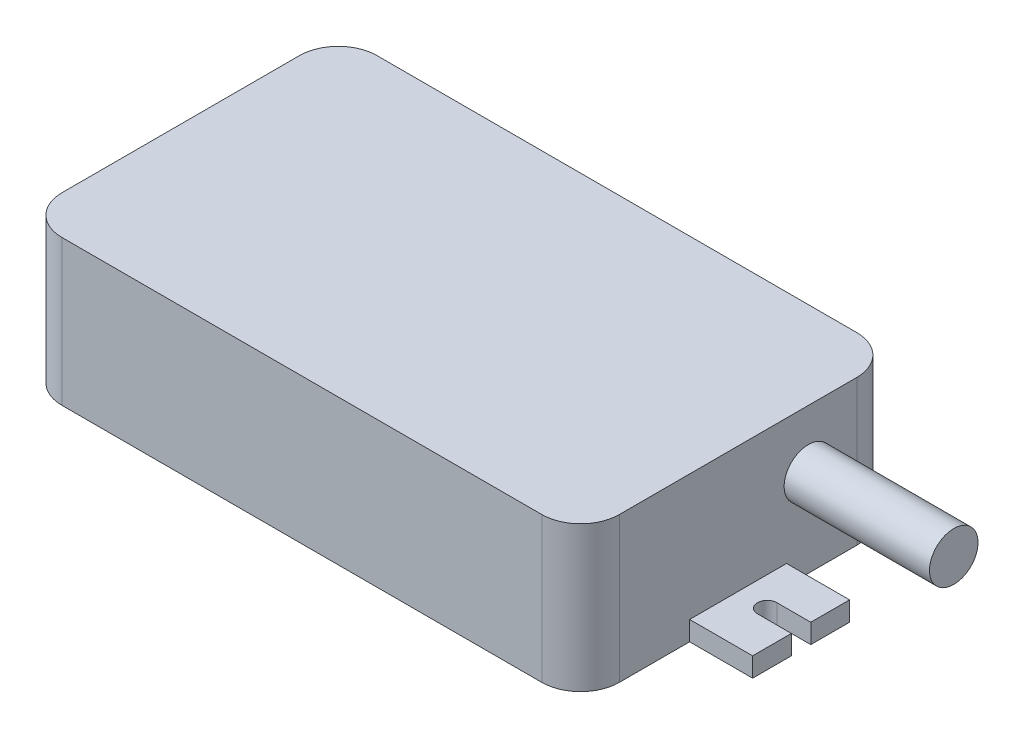
from build123d import *

# Parameters (mm, degrees)
SKETCH1_W           = 115
SKETCH1_H           = 65
BOSS_EXTRUDE1_DEPTH = 30
BOSS_EXTRUDE2_DEPTH = 4
SKETCH4_R           = 5
BOSS_EXTRUDE3_DEPTH = 30
FILLET1_R           = 8


with BuildPart() as part:
    # Sketch1 → Boss-Extrude1 (new body)
    with BuildSketch(Plane(origin=(0, 0, 0), x_dir=(1, 0, 0), z_dir=(0, 1, 0))):
        Rectangle(SKETCH1_W, SKETCH1_H)
    extrude(amount=BOSS_EXTRUDE1_DEPTH)

    # Sketch3 → Boss-Extrude2 (add)
    with BuildSketch(Plane.XZ):
        with BuildLine():
            Line((-70.5, 10), (70.5, 10))
            Line((70.5, 10), (70.5, 2))
            Line((70.5, 2), (63.5, 2))
            ThreePointArc((63.5, 2), (61.5, 0), (63.5, -2))
            Line((63.5, -2), (70.5, -2))
            Line((70.5, -2), (70.5, -10))
            Line((70.5, -10), (-70.5, -10))
            Line((-70.5, -10), (-70.5, -2))
            Line((-70.5, -2), (-63.5, -2))
            ThreePointArc((-63.5, -2), (-61.5, 0), (-63.5, 2))
            Line((-63.5, 2), (-70.5, 2))
            Line((-70.5, 2), (-70.5, 10))
        make_face()
    extrude(amount=-BOSS_EXTRUDE2_DEPTH)

    # Sketch4 → Boss-Extrude3 (add)
    with BuildSketch(Plane(origin=(57.5, 0, 0), x_dir=(0, 0, -1), z_dir=(1, 0, 0))):
        with Locations(Location((14.5, 18, 0), (0, 0, 180))):
            Circle(SKETCH4_R)
    extrude(amount=BOSS_EXTRUDE3_DEPTH)

    # Fillet1
    fillet1_edges = [part.edges().sort_by_distance(p)[0] for p in [
        (-57.5, 15, -32.5),
        (57.5, 15, -32.5),
        (57.5, 15, 32.5),
        (-57.5, 15, 32.5),
    ]]
    fillet(fillet1_edges, radius=FILLET1_R)


solid = part.part
